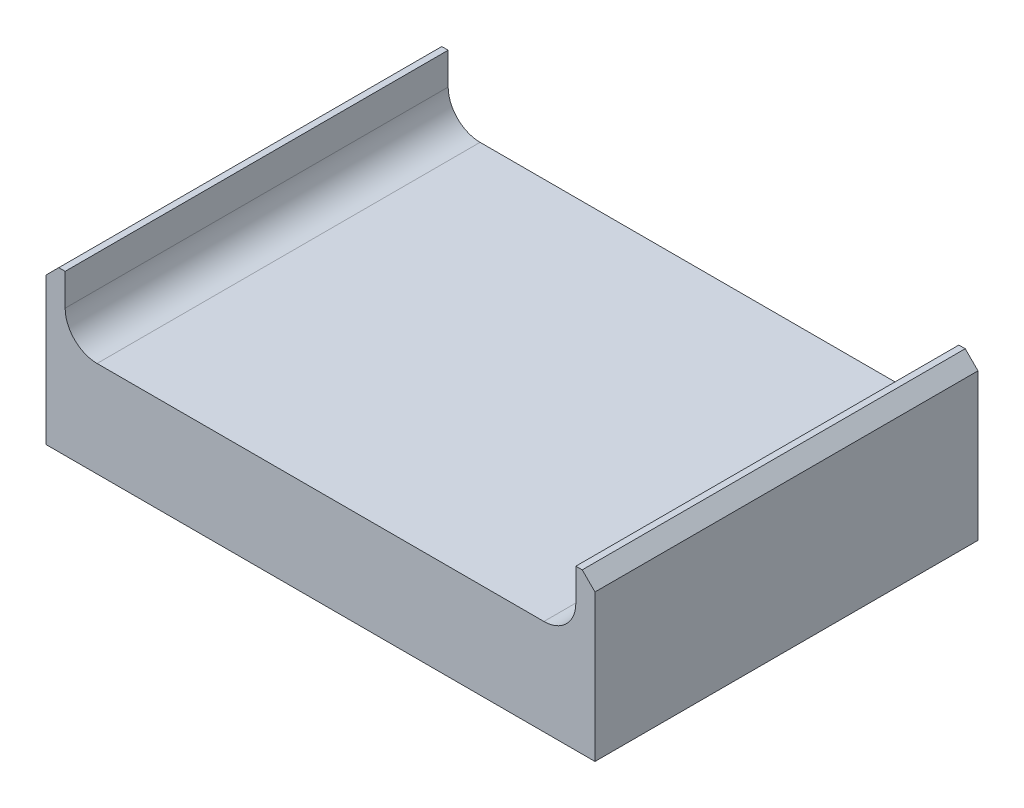
from build123d import *

# Parameters (mm, degrees)
BOSS_EXTRUDE1_DEPTH = 60
FILLET1_R           = 5
CHAMFER1_SIZE       = 2


with BuildPart() as part:
    # Sketch1 → Boss-Extrude1 (new body)
    with BuildSketch(Plane.XY):
        Polygon((40, 12.5), (43, 12.5), (43, -12.5), (-43, -12.5), (-43, 12.5), (-40, 12.5), (-40, 2.5), (40, 2.5), align=None)
    extrude(amount=BOSS_EXTRUDE1_DEPTH)

    # Fillet1
    fillet1_edges = [part.edges().sort_by_distance(p)[0] for p in [
        (-40, 2.5, 30),
        (40, 2.5, 30),
    ]]
    fillet(fillet1_edges, radius=FILLET1_R)

    # Chamfer1
    chamfer1_edges = [part.edges().sort_by_distance(p)[0] for p in [
        (-43, 12.5, 30),
        (43, 12.5, 30),
    ]]
    chamfer(chamfer1_edges, length=CHAMFER1_SIZE)


solid = part.part
